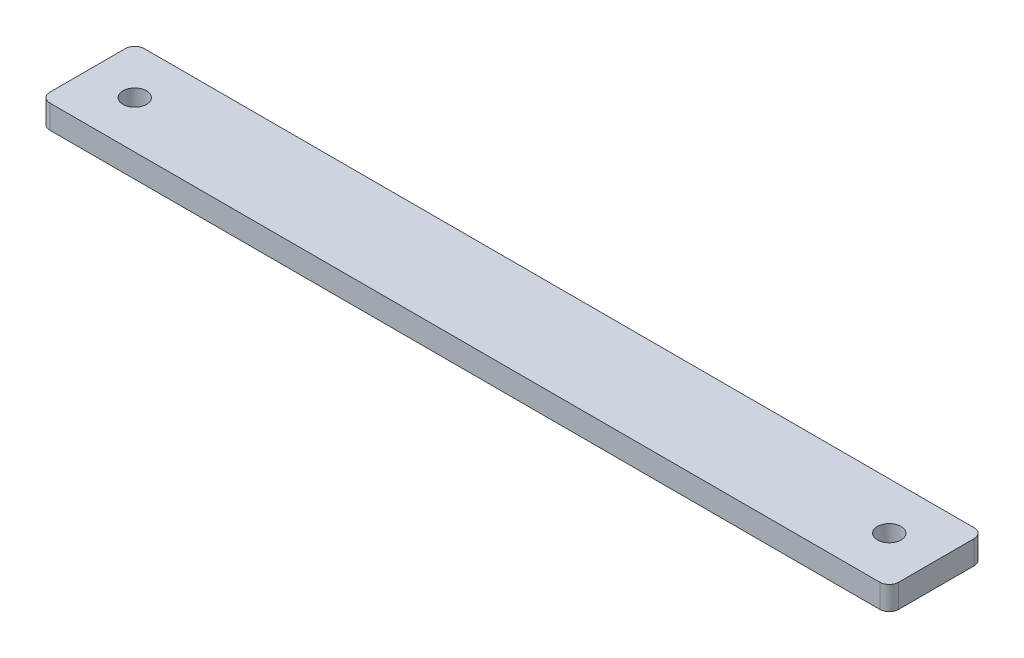
from build123d import *

# Parameters (mm, degrees)
SKETCH1_W               = 228.6
SKETCH1_H               = 25.4
BOSS_EXTRUDE1_DEPTH     = 6.35
CUT_EXTRUDE1_DEPTH      = 231.094420836
CUT_EXTRUDE1_DEPTH_BACK = 231.094420836
SKETCH2_R               = 3.175
FILLET1_R               = 2.54


with BuildPart() as part:
    # Sketch1 → Boss-Extrude1 (new body)
    with BuildSketch(Plane(origin=(0, 0, 0), x_dir=(1, 0, 0), z_dir=(0, 1, 0))):
        with Locations((114.3, 12.7)):
            Rectangle(SKETCH1_W, SKETCH1_H)
    extrude(amount=BOSS_EXTRUDE1_DEPTH)

    # Sketch2 → Cut-Extrude1 (cut, two sides: drawn at the far end of the back side and taken through both)
    with BuildSketch(Plane(origin=(0, 6.35, 0), x_dir=(1, 0, 0), z_dir=(0, 1, 0)).offset(-CUT_EXTRUDE1_DEPTH_BACK)):
        with Locations(Location((12.7, 12.7, 0), (0, 0, 270))):
            Circle(SKETCH2_R)
        with Locations(Location((215.9, 12.7, 0), (0, 0, 270))):
            Circle(SKETCH2_R)
    extrude(amount=CUT_EXTRUDE1_DEPTH + CUT_EXTRUDE1_DEPTH_BACK, mode=Mode.SUBTRACT)

    # Fillet1
    fillet1_edges = [part.edges().sort_by_distance(p)[0] for p in [
        (0, 3.175, -25.4),
        (228.6, 3.175, -25.4),
        (228.6, 3.175, 0),
        (0, 3.175, 0),
    ]]
    fillet(fillet1_edges, radius=FILLET1_R)


solid = part.part
